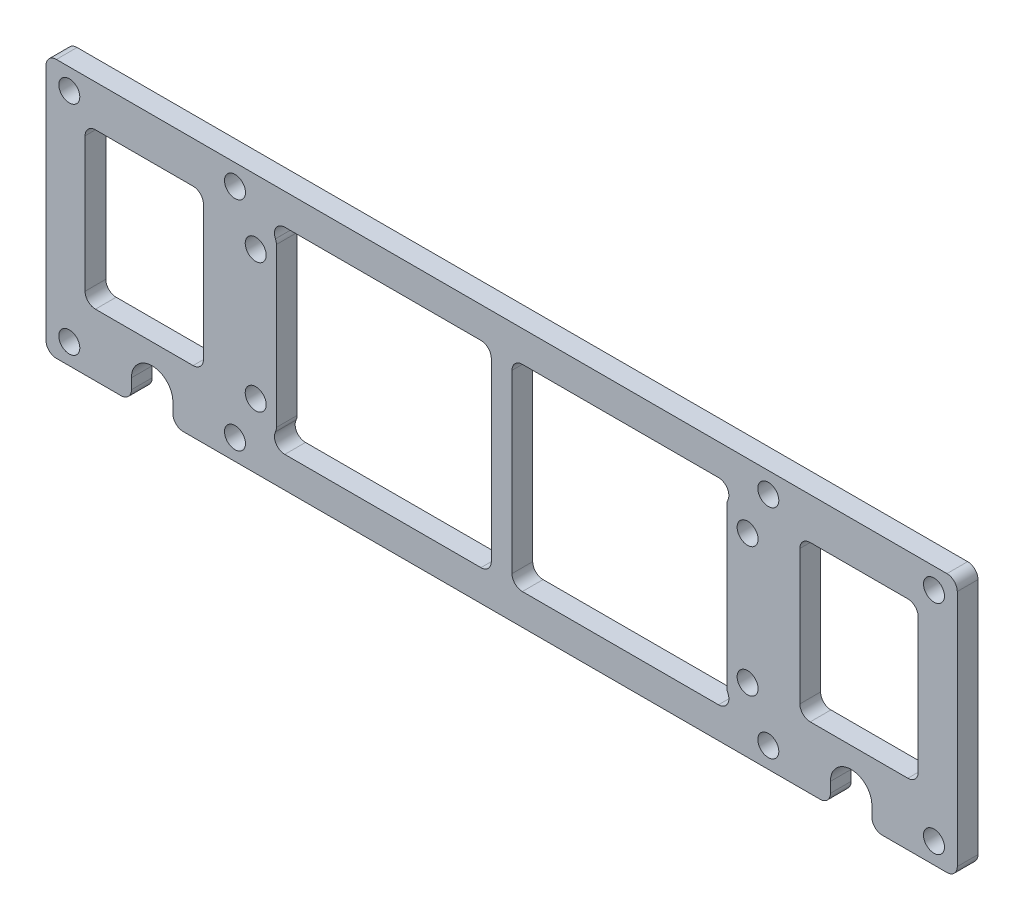
from build123d import *

# Parameters (mm, degrees)
SKETCH_1_W          = 176
SKETCH_1_H          = 50
EXTRUDE_1_DEPTH     = 2
SKETCH_2_R          = 2.025
CUT_EXTRUDE_1_DEPTH = 22
CUT_EXTRUDE_2_DEPTH = 17
FILLET_1_R          = 2
SKETCH_4_R          = 2.025
CUT_EXTRUDE_3_DEPTH = 5
CUT_EXTRUDE_5_DEPTH = 15.5
SKETCH_8_W          = 22.857142857
SKETCH_8_H          = 30
CUT_EXTRUDE_6_DEPTH = 15.5
FILLET_2_R          = 2


with BuildPart() as part:
    # 草图1 → 凸台-拉伸1 (new, symmetric)
    with BuildSketch(Plane.XY):
        Rectangle(SKETCH_1_W, SKETCH_1_H)
    extrude(amount=EXTRUDE_1_DEPTH, both=True)

    # 草图2 → 切除-拉伸1 (cut, symmetric)
    with BuildSketch(Plane(origin=(0, 0, -2), x_dir=(-1, 0, 0), z_dir=(0, 0, -1))):
        with Locations((51.5, 21)):
            Circle(SKETCH_2_R)
        with Locations((51.5, -21)):
            Circle(SKETCH_2_R)
        with Locations((83.5, 21)):
            Circle(SKETCH_2_R)
        with Locations((83.5, -21)):
            Circle(SKETCH_2_R)
    cut_extrude_1 = extrude(amount=CUT_EXTRUDE_1_DEPTH, both=True, mode=Mode.SUBTRACT)

    # 镜向1: 切除-拉伸1 across plane
    add(cut_extrude_1.mirror(Plane(origin=(0, 0, 0), x_dir=(0, 0, 1), z_dir=(1, 0, 0))), mode=Mode.SUBTRACT)

    # 草图3 → 切除-拉伸2 (cut, symmetric)
    with BuildSketch(Plane(origin=(0, 0, -2), x_dir=(-1, 0, 0), z_dir=(0, 0, -1))):
        with BuildLine():
            Line((63.5, -21), (63.5, -25))
            Line((63.5, -25), (71.5, -25))
            Line((71.5, -25), (71.5, -21))
            ThreePointArc((71.5, -21), (67.5, -17), (63.5, -21))
        make_face()
    cut_extrude_2 = extrude(amount=CUT_EXTRUDE_2_DEPTH, both=True, mode=Mode.SUBTRACT)

    # 镜向2: 切除-拉伸2 across plane
    add(cut_extrude_2.mirror(Plane(origin=(0, 0, 0), x_dir=(0, 0, 1), z_dir=(1, 0, 0))), mode=Mode.SUBTRACT)

    # 圆角1
    fillet_1_edges = [part.edges().sort_by_distance(p)[0] for p in [
        (-71.5, -25, 0),
        (-63.5, -25, 0),
        (88, -25, 0),
        (-88, -25, 0),
        (-88, 25, 0),
        (88, 25, 0),
        (63.5, -25, 0),
        (71.5, -25, 0),
    ]]
    fillet(fillet_1_edges, radius=FILLET_1_R)

    # 草图4 → 切除-拉伸3 (cut, symmetric)
    with BuildSketch(Plane(origin=(0, 0, -2), x_dir=(-1, 0, 0), z_dir=(0, 0, -1))):
        with Locations((47.5, -12.5)):
            Circle(SKETCH_4_R)
        with Locations((47.5, 12.5)):
            Circle(SKETCH_4_R)
        with Locations((-47.5, 12.5)):
            Circle(SKETCH_4_R)
        with Locations((-47.5, -12.5)):
            Circle(SKETCH_4_R)
    extrude(amount=CUT_EXTRUDE_3_DEPTH, both=True, mode=Mode.SUBTRACT)

    # 草图7 → 切除-拉伸5 (cut, symmetric)
    with BuildSketch(Plane.XY.offset(2)):
        Polygon((-2, 19), (-45.032854639, 19), (-43.5, 15.742683893), (-43.5, -15.742683893), (-45.032854639, -19), (-2, -19), align=None)
        Polygon((45.032854639, 19), (2, 19), (2, -19), (45.032854639, -19), (43.5, -15.742683893), (43.5, 15.742683893), align=None)
    extrude(amount=CUT_EXTRUDE_5_DEPTH, both=True, mode=Mode.SUBTRACT)

    # 草图8 → 切除-拉伸6 (cut, symmetric)
    with BuildSketch(Plane.XY.offset(2)):
        with Locations((-69.023809524, 2)):
            Rectangle(SKETCH_8_W, SKETCH_8_H)
        with Locations((69.023809524, 2)):
            Rectangle(SKETCH_8_W, SKETCH_8_H)
    extrude(amount=CUT_EXTRUDE_6_DEPTH, both=True, mode=Mode.SUBTRACT)

    # 圆角2
    fillet_2_edges = [part.edges().sort_by_distance(p)[0] for p in [
        (-2, 19, 0),
        (-2, -19, 0),
        (-45.032854639, -19, 0),
        (-43.5, -15.742683893, 0),
        (-43.5, 15.742683893, 0),
        (-45.032854639, 19, 0),
        (2, 19, 0),
        (45.032854639, 19, 0),
        (43.5, 15.742683893, 0),
        (43.5, -15.742683893, 0),
        (45.032854639, -19, 0),
        (2, -19, 0),
        (-80.452380952, -13, 0),
        (-80.452380952, 17, 0),
        (-57.595238095, 17, 0),
        (-57.595238095, -13, 0),
        (80.452380952, 17, 0),
        (80.452380952, -13, 0),
        (57.595238095, -13, 0),
        (57.595238095, 17, 0),
    ]]
    fillet(fillet_2_edges, radius=FILLET_2_R)


solid = part.part
